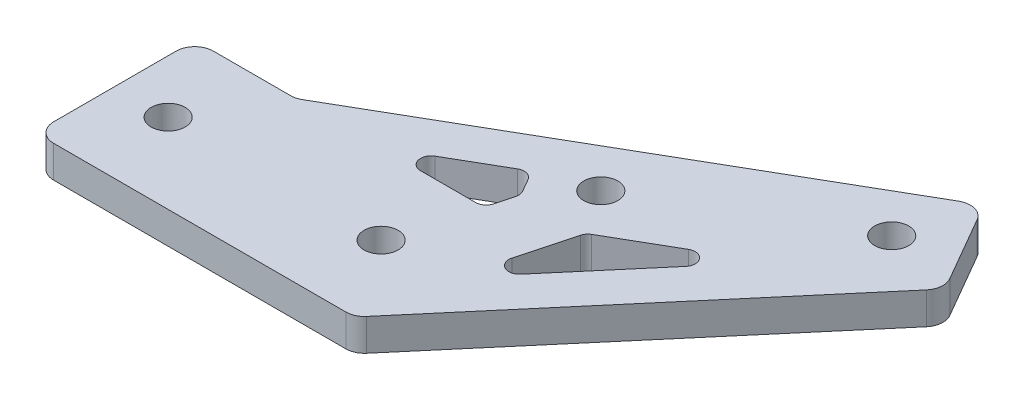
from build123d import *

# Parameters (mm, degrees)
SKETCH_2_R          = 1.6
EXTRUDE_1_DEPTH     = 1.5
CUT_EXTRUDE_1_DEPTH = 3
FILLET_1_R          = 1
FILLET_2_R          = 1.75


with BuildPart() as part:
    # ｽｹｯﾁ2 → ﾎﾞｽ - 押し出し1 (new, symmetric)
    with BuildSketch(Plane(origin=(0, 0, 0), x_dir=(1, 0, 0), z_dir=(0, 1, 0))):
        Polygon((24.47, 8.660254038), (9.47, 0), (0, 0), (0, -15), (30, -15), (55.450762114, 15), (50.450762114, 23.660254038), align=None)
        with Locations(Location((48.620635095, 16.830127019, 0), (0, 0, 270))):
            Circle(SKETCH_2_R, mode=Mode.SUBTRACT)
        with Locations(Location((25, -7.5, 0), (0, 0, 270))):
            Circle(SKETCH_2_R, mode=Mode.SUBTRACT)
        with Locations(Location((31.300127019, 6.830127019, 0), (0, 0, 270))):
            Circle(SKETCH_2_R, mode=Mode.SUBTRACT)
        with Locations(Location((5, -7.5, 0), (0, 0, 270))):
            Circle(SKETCH_2_R, mode=Mode.SUBTRACT)
    extrude(amount=EXTRUDE_1_DEPTH, both=True)

    # ｽｹｯﾁ3 → ｶｯﾄ - 押し出し1 (cut)
    with BuildSketch(Plane(origin=(0, 1.5, 0), x_dir=(1, 0, 0), z_dir=(0, 1, 0))):
        Polygon((26.47, 5.196152423), (17.47, 0), (27.140628594, 0), (27.879009742, 2.755675961), align=None)
        Polygon((33.352285677, 0), (37.479868618, 0), (45.169472556, 9.064094706), (34.062793268, 2.651650429), align=None)
        Polygon((31.44676478, -7.111500799), (37.479868618, 0), (33.352285677, 0), align=None)
    extrude(amount=-CUT_EXTRUDE_1_DEPTH, mode=Mode.SUBTRACT)

    # ﾌｨﾚｯﾄ1
    fillet_1_edges = [part.edges().sort_by_distance(p)[0] for p in [
        (27.879009742, 0, -2.755675961),
        (27.140628594, 0, 0),
        (17.47, 0, 0),
        (26.47, 0, -5.196152423),
        (34.062793268, 0, -2.651650429),
        (45.169472556, 0, -9.064094706),
        (31.44676478, 0, 7.111500799),
    ]]
    fillet(fillet_1_edges, radius=FILLET_1_R)

    # ﾌｨﾚｯﾄ2
    fillet_2_edges = [part.edges().sort_by_distance(p)[0] for p in [
        (50.450762114, 0, -23.660254038),
        (55.450762114, 0, -15),
        (30, 0, 15),
        (0, 0, 15),
        (0, 0, 0),
        (9.47, 0, 0),
    ]]
    fillet(fillet_2_edges, radius=FILLET_2_R)


solid = part.part
